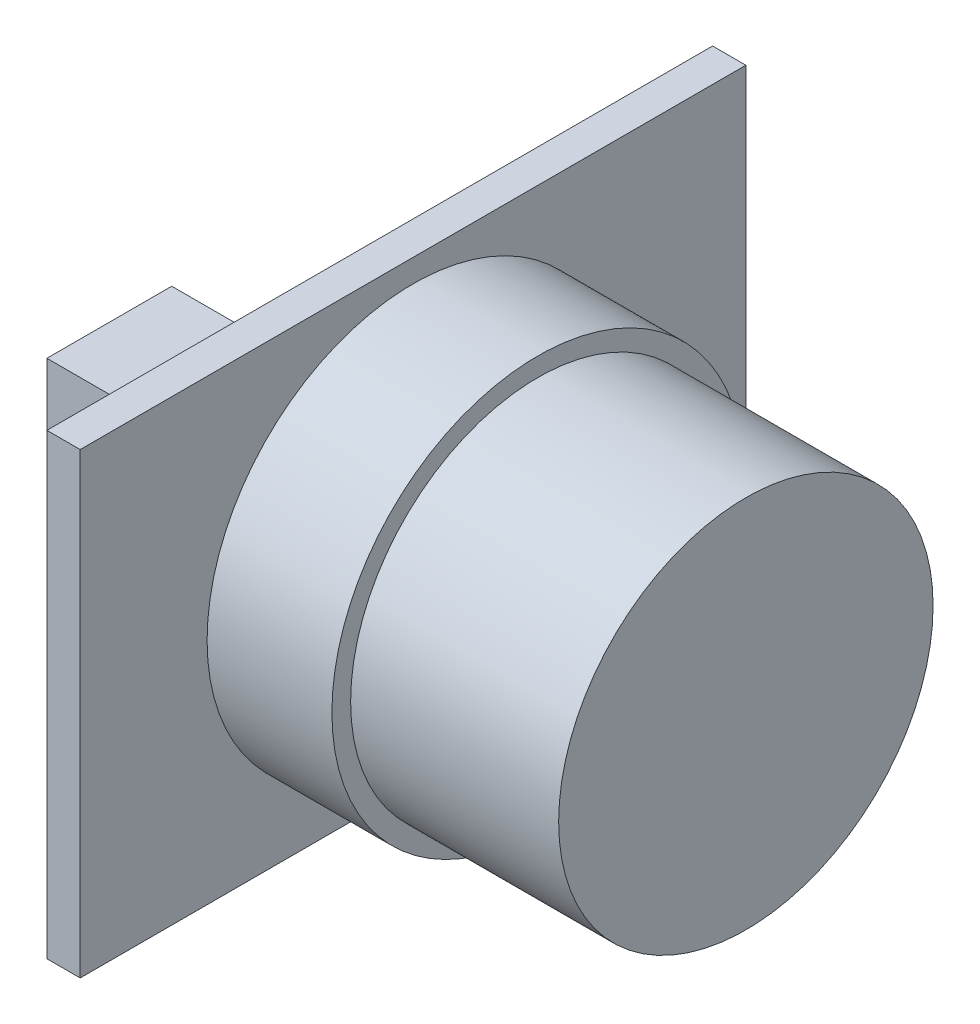
from build123d import *

# Parameters (mm, degrees)
SKETCH1_W           = 1.6
SKETCH1_H           = 22
BOSS_EXTRUDE1_DEPTH = 32
SKETCH2_R           = 9.9
BOSS_EXTRUDE2_DEPTH = 6
SKETCH3_R           = 9
BOSS_EXTRUDE3_DEPTH = 10
SKETCH4_W           = 6
SKETCH4_H           = 6
BOSS_EXTRUDE4_DEPTH = 6


with BuildPart() as part:
    # Sketch1 → Boss-Extrude1 (new body)
    with BuildSketch(Plane.XY.offset(9)):
        with Locations((30, -121.5)):
            Rectangle(SKETCH1_W, SKETCH1_H)
    extrude(amount=BOSS_EXTRUDE1_DEPTH)

    # Sketch2 → Boss-Extrude2 (add)
    with BuildSketch(Plane(origin=(30.8, 0, 0), x_dir=(0, 0, -1), z_dir=(1, 0, 0))):
        with Locations((-25, -121.5)):
            Circle(SKETCH2_R)
    extrude(amount=BOSS_EXTRUDE2_DEPTH)

    # Sketch3 → Boss-Extrude3 (add)
    with BuildSketch(Plane(origin=(36.8, 0, 0), x_dir=(0, 0, -1), z_dir=(1, 0, 0))):
        with Locations((-25, -121.5)):
            Circle(SKETCH3_R)
    extrude(amount=BOSS_EXTRUDE3_DEPTH)

    # Sketch4 → Boss-Extrude4 (add)
    with BuildSketch(Plane.XY.offset(29)):
        with Locations((26.2, -116.5)):
            Rectangle(SKETCH4_W, SKETCH4_H)
    extrude(amount=BOSS_EXTRUDE4_DEPTH)


solid = part.part
